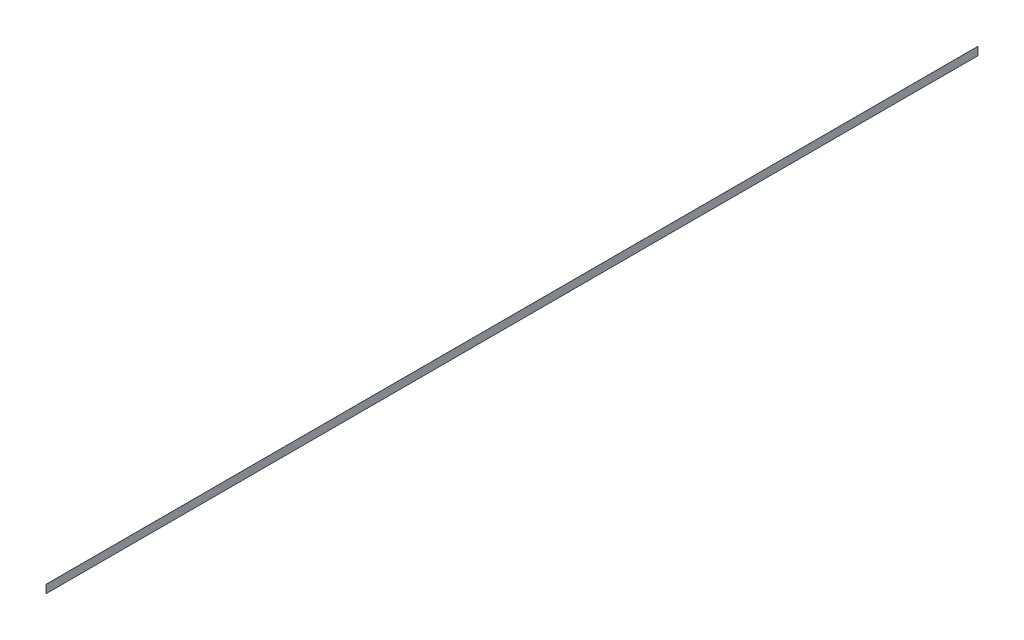
from build123d import *

# Parameters (mm, degrees)
SKETCH1_W           = 0.2
SKETCH1_H           = 35
BOSS_EXTRUDE1_DEPTH = 4000


with BuildPart() as part:
    # Sketch1 → Boss-Extrude1 (new body)
    with BuildSketch(Plane.XY):
        Rectangle(SKETCH1_W, SKETCH1_H)
    extrude(amount=BOSS_EXTRUDE1_DEPTH)


solid = part.part
